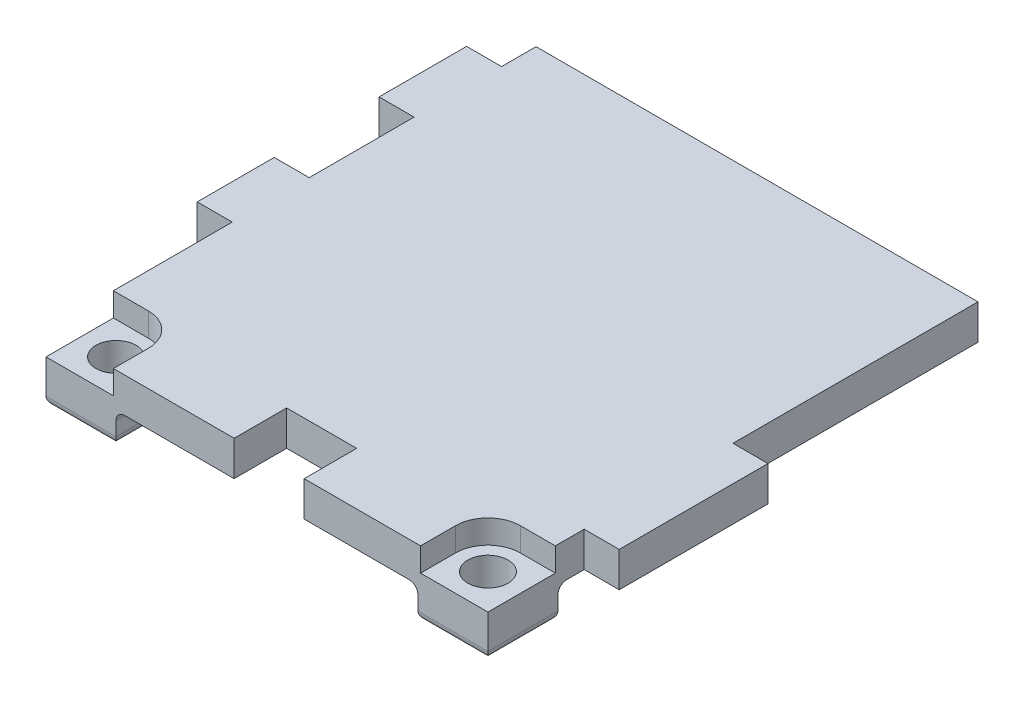
from build123d import *

# Parameters (mm, degrees)
SKETCH_1_W               = 25.25
SKETCH_1_H               = 26
EXTRUDE_1_DEPTH          = 2
SKETCH_3_W               = 4
SKETCH_3_H               = 4
EXTRUDE_2_DEPTH          = 1.8
CUT_EXTRUDE_2_DEPTH      = 2
CUT_EXTRUDE_2_DEPTH_BACK = 1.8
SKETCH_4_R               = 1.15
SKETCH_5_R               = 1.85
CUT_EXTRUDE_3_DEPTH      = 1.35
SKETCH_7_W               = 25.25
SKETCH_7_H               = 2
EXTRUDE_4_DEPTH          = 2
FILLET_3_R               = 0.5
SKETCH_8_W               = 8.5
SKETCH_8_H               = 2
EXTRUDE_5_DEPTH          = 2
SKETCH_9_W               = 5
SKETCH_9_H               = 2
EXTRUDE_6_DEPTH          = 2
SKETCH_10_W              = 4.4
SKETCH_10_H              = 2
EXTRUDE_7_DEPTH          = 2
SKETCH_11_W              = 4
SKETCH_11_H              = 3
CUT_EXTRUDE_4_DEPTH      = 2
CUT_EXTRUDE_5_DEPTH      = 1.35


with BuildPart() as part:
    # 草图1 → 凸台-拉伸1 (new body)
    with BuildSketch(Plane(origin=(0, 0, 0), x_dir=(1, 0, 0), z_dir=(0, 1, 0))):
        Rectangle(SKETCH_1_W, SKETCH_1_H)
    extrude(amount=EXTRUDE_1_DEPTH)

    # 草图3 → 凸台-拉伸2 (add)
    with BuildSketch(Plane(origin=(0, 0, 0), x_dir=(1, 0, 0), z_dir=(0, 1, 0))):
        with Locations((-10.625, -11)):
            Rectangle(SKETCH_3_W, SKETCH_3_H)
        with Locations((10.625, -11)):
            Rectangle(SKETCH_3_W, SKETCH_3_H)
    extrude(amount=-EXTRUDE_2_DEPTH)

    # 草图4 → 切除-拉伸2 (cut, two sides: drawn at the far end of the back side and taken through both)
    with BuildSketch(Plane(origin=(0, 0, 0), x_dir=(1, 0, 0), z_dir=(0, 1, 0)).offset(-CUT_EXTRUDE_2_DEPTH_BACK)):
        with Locations(Location((-10.625, -11, 0), (0, 0, 270))):
            Circle(SKETCH_4_R)
        with Locations(Location((10.625, -11, 0), (0, 0, 90))):
            Circle(SKETCH_4_R)
    extrude(amount=CUT_EXTRUDE_2_DEPTH + CUT_EXTRUDE_2_DEPTH_BACK, mode=Mode.SUBTRACT)

    # 草图5 → 切除-拉伸3 (cut)
    with BuildSketch(Plane(origin=(0, 2, 0), x_dir=(1, 0, 0), z_dir=(0, 1, 0))):
        with Locations(Location((-10.625, -11, 0), (0, 0, 270))):
            Circle(SKETCH_5_R)
        with Locations(Location((10.625, -11, 0), (0, 0, 270))):
            Circle(SKETCH_5_R)
    extrude(amount=-CUT_EXTRUDE_3_DEPTH, mode=Mode.SUBTRACT)

    # 草图7 → 凸台-拉伸4 (add)
    with BuildSketch(Plane(origin=(0, 0, -13), x_dir=(-1, 0, 0), z_dir=(0, 0, -1))):
        with Locations((0, 1)):
            Rectangle(SKETCH_7_W, SKETCH_7_H)
    extrude(amount=EXTRUDE_4_DEPTH)

    # 圆角3
    fillet_3_edges = [part.edges().sort_by_distance(p)[0] for p in [
        (-12.625, -1.8, 11),
        (-10.625, -1.8, 9),
        (-8.625, -1.8, 11),
        (-10.625, -1.8, 13),
        (-8.625, 0, 11),
        (-10.625, 0, 9),
        (12.625, -1.8, 11),
        (10.625, -1.8, 13),
        (8.625, -1.8, 11),
        (10.625, -1.8, 9),
        (10.625, 0, 9),
        (8.625, 0, 11),
    ]]
    fillet(fillet_3_edges, radius=FILLET_3_R)

    # 草图8 → 凸台-拉伸5 (add)
    with BuildSketch(Plane(origin=(12.625, 0, 0), x_dir=(0, 0, -1), z_dir=(1, 0, 0))):
        with Locations((-3.25, 1)):
            Rectangle(SKETCH_8_W, SKETCH_8_H)
    extrude(amount=EXTRUDE_5_DEPTH)

    # 草图9 → 凸台-拉伸6 (add)
    with BuildSketch(Plane.ZY.offset(12.625)):
        with Locations((-10.530736821, 1)):
            Rectangle(SKETCH_9_W, SKETCH_9_H)
    extrude(amount=EXTRUDE_6_DEPTH)

    # 草图10 → 凸台-拉伸7 (add)
    with BuildSketch(Plane.ZY.offset(12.625)):
        with Locations((0.16, 1)):
            Rectangle(SKETCH_10_W, SKETCH_10_H)
    extrude(amount=EXTRUDE_7_DEPTH)

    # 草图11 → 切除-拉伸4 (cut)
    with BuildSketch(Plane(origin=(0, 2, 0), x_dir=(1, 0, 0), z_dir=(0, 1, 0))):
        with Locations((0.125, -11.5)):
            Rectangle(SKETCH_11_W, SKETCH_11_H)
    extrude(amount=-CUT_EXTRUDE_4_DEPTH, mode=Mode.SUBTRACT)

    # 草图12 → 切除-拉伸5 (cut)
    with BuildSketch(Plane(origin=(0, 2, 0), x_dir=(1, 0, 0), z_dir=(0, 1, 0))):
        Polygon((-10.625, -9.15), (-12.625, -9.15), (-12.625, -13), (-8.775, -13), (-8.775, -11), align=None)
        Polygon((8.775, -11), (10.625, -9.15), (12.625, -9.15), (12.625, -13), (8.775, -13), align=None)
    extrude(amount=-CUT_EXTRUDE_5_DEPTH, mode=Mode.SUBTRACT)


solid = part.part
